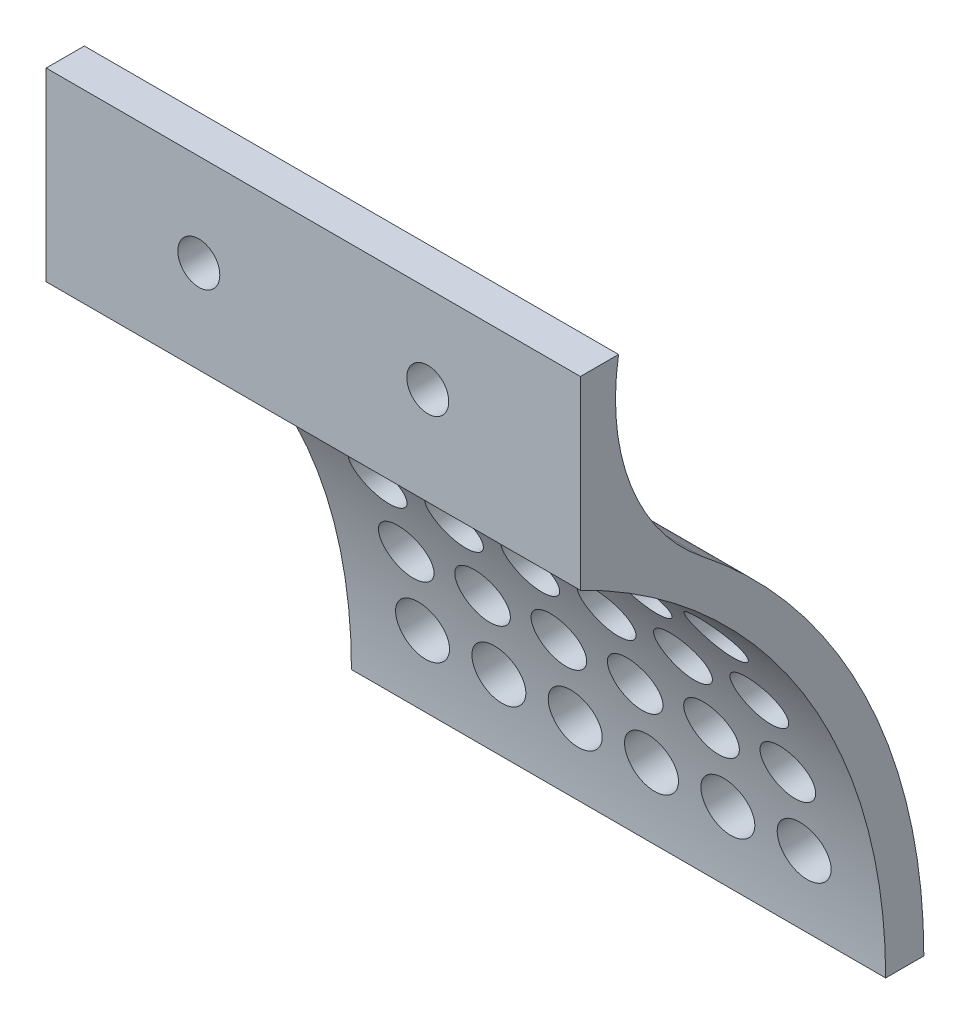
from build123d import *

# Parameters (mm, degrees)
SALIENTE_EXTRUIR1_DEPTH = 70
CROQUIS3_R              = 3.5
CORTAR_EXTRUIR3_DEPTH   = 65
CROQUIS2_R              = 2.750000002
CROQUIS2_R_2            = 2.75
CORTAR_EXTRUIR4_DEPTH   = 65


with BuildPart() as part:
    # Croquis1 → Saliente-Extruir1 (new body)
    with BuildSketch(Plane(origin=(0, 0, 0), x_dir=(0, 0, -1), z_dir=(1, 0, 0))):
        with BuildLine():
            Line((-25.193840863, 53.195024044), (-20.193840863, 53.195024044))
            ThreePointArc((-20.193840863, 53.195024044), (-18.573108699, 37.469004774), (-9.183016609, 24.750489713))
            ThreePointArc((-9.183016609, 24.750489713), (12.176943033, -1.828536951), (19.806159137, -35.062369049))
            Line((19.806159137, -35.062369049), (14.806159137, -35.062369049))
            ThreePointArc((14.806159137, -35.062369049), (3.983638383, 2.673555479), (-25.193840863, 28.937630951))
            Line((-25.193840863, 28.937630951), (-25.193840863, 53.195024044))
        make_face()
    extrude(amount=SALIENTE_EXTRUIR1_DEPTH)

    # Croquis3 → Cortar-Extruir3 (cut)
    with BuildSketch(Plane.XY.offset(-19.806159137)):
        with Locations(Location((60, 14.750489713, 0), (0, 0, 180))):
            Circle(CROQUIS3_R)
        with Locations(Location((50, 14.750489713, 0), (0, 0, 180))):
            Circle(CROQUIS3_R)
        with Locations(Location((40, 14.750489713, 0), (0, 0, 180))):
            Circle(CROQUIS3_R)
        with Locations(Location((30, 14.750489713, 0), (0, 0, 180))):
            Circle(CROQUIS3_R)
        with Locations(Location((20, 14.750489713, 0), (0, 0, 180))):
            Circle(CROQUIS3_R)
        with Locations(Location((10, 14.750489713, 0), (0, 0, 180))):
            Circle(CROQUIS3_R)
        with Locations(Location((50, 4.750489713, 0), (0, 0, 180))):
            Circle(CROQUIS3_R)
        with Locations(Location((40, 4.750489713, 0), (0, 0, 180))):
            Circle(CROQUIS3_R)
        with Locations(Location((30, 4.750489713, 0), (0, 0, 180))):
            Circle(CROQUIS3_R)
        with Locations(Location((20, 4.750489713, 0), (0, 0, 180))):
            Circle(CROQUIS3_R)
        with Locations(Location((40, -5.249510287, 0), (0, 0, 180))):
            Circle(CROQUIS3_R)
        with Locations(Location((60, 4.750489713, 0), (0, 0, 180))):
            Circle(CROQUIS3_R)
        with Locations(Location((20, -5.249510287, 0), (0, 0, 180))):
            Circle(CROQUIS3_R)
        with Locations(Location((30, -5.249510287, 0), (0, 0, 180))):
            Circle(CROQUIS3_R)
        with Locations(Location((50, -5.249510287, 0), (0, 0, 180))):
            Circle(CROQUIS3_R)
        with Locations(Location((60, -5.249510287, 0), (0, 0, 180))):
            Circle(CROQUIS3_R)
        with Locations(Location((20, -15.249510287, 0), (0, 0, 180))):
            Circle(CROQUIS3_R)
        with Locations(Location((30, -15.249510287, 0), (0, 0, 180))):
            Circle(CROQUIS3_R)
        with Locations(Location((40, -15.249510287, 0), (0, 0, 180))):
            Circle(CROQUIS3_R)
        with Locations(Location((50, -15.249510287, 0), (0, 0, 180))):
            Circle(CROQUIS3_R)
        with Locations(Location((60, -15.249510287, 0), (0, 0, 180))):
            Circle(CROQUIS3_R)
        with Locations(Location((20, -25.249510287, 0), (0, 0, 180))):
            Circle(CROQUIS3_R)
        with Locations(Location((30, -25.249510287, 0), (0, 0, 180))):
            Circle(CROQUIS3_R)
        with Locations(Location((40, -25.249510287, 0), (0, 0, 180))):
            Circle(CROQUIS3_R)
        with Locations(Location((50, -25.249510287, 0), (0, 0, 180))):
            Circle(CROQUIS3_R)
        with Locations(Location((60, -25.249510287, 0), (0, 0, 180))):
            Circle(CROQUIS3_R)
        with Locations(Location((10, 4.750489713, 0), (0, 0, 180))):
            Circle(CROQUIS3_R)
        with Locations(Location((10, -5.249510287, 0), (0, 0, 180))):
            Circle(CROQUIS3_R)
        with Locations(Location((10, -15.249510287, 0), (0, 0, 180))):
            Circle(CROQUIS3_R)
        with Locations(Location((10, -25.249510287, 0), (0, 0, 180))):
            Circle(CROQUIS3_R)
    extrude(amount=CORTAR_EXTRUIR3_DEPTH, mode=Mode.SUBTRACT)

    # Croquis2 → Cortar-Extruir4 (cut)
    with BuildSketch(Plane.XY.offset(25.193840863)):
        with Locations((20, 41.066327497)):
            Circle(CROQUIS2_R)
        with Locations((50, 41.717136777)):
            Circle(CROQUIS2_R_2)
    extrude(amount=-CORTAR_EXTRUIR4_DEPTH, mode=Mode.SUBTRACT)


solid = part.part
